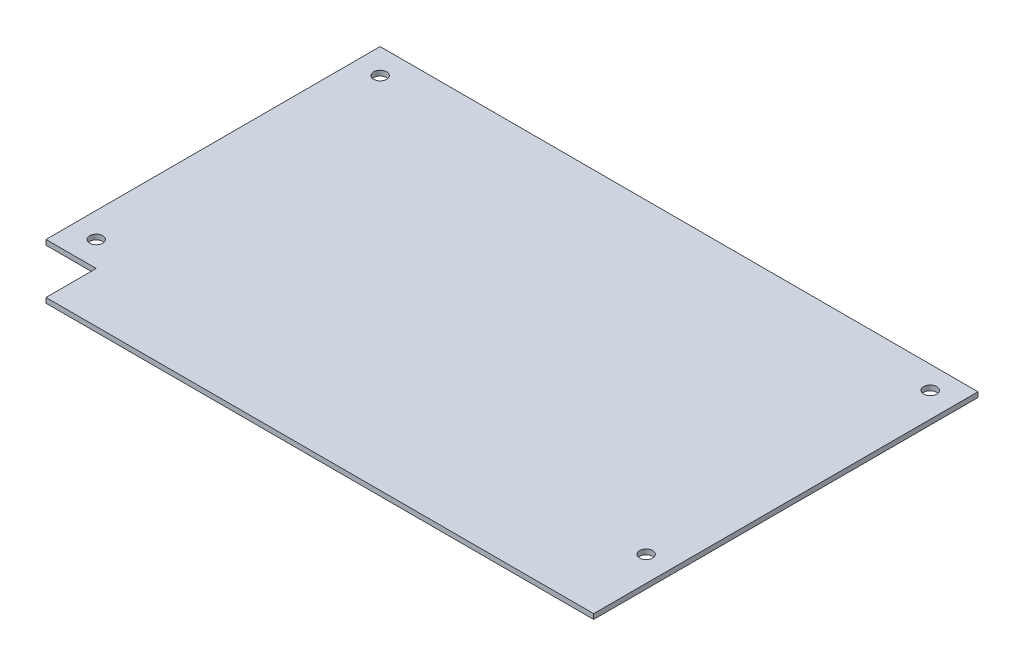
from build123d import *

# Parameters (mm, degrees)
P_IDAT_VYSUNUT_M1_DEPTH  = 2
SKICA2_R                 = 2.6
ODEBRAT_VYSUNUT_M1_DEPTH = 2
SKICA3_R                 = 2.6
ODEBRAT_VYSUNUT_M2_DEPTH = 2


with BuildPart() as part:
    # Skica1 → Přidat vysunutím1 (new body)
    with BuildSketch(Plane(origin=(0, 0, 0), x_dir=(1, 0, 0), z_dir=(0, 1, 0))):
        Polygon((119, -76.5), (-99, -76.5), (-99, -56.5), (-119, -56.5), (-119, 76.5), (119, 76.5), align=None)
    extrude(amount=P_IDAT_VYSUNUT_M1_DEPTH)

    # Skica2 → Odebrat vysunutím1 (cut)
    with BuildSketch(Plane.XZ):
        with Locations(Location((109, 45.604467717, 0), (0, 0, 270))):
            Circle(SKICA2_R)
        with Locations(Location((109, -67.457548012, 0), (0, 0, 270))):
            Circle(SKICA2_R)
    extrude(amount=-ODEBRAT_VYSUNUT_M1_DEPTH, mode=Mode.SUBTRACT)

    # Skica3 → Odebrat vysunutím2 (cut)
    with BuildSketch(Plane(origin=(0, 2, 0), x_dir=(1, 0, 0), z_dir=(0, 1, 0))):
        with Locations(Location((-109, 66.5, 0), (0, 0, 270))):
            Circle(SKICA3_R)
        with Locations(Location((-109, -46.5, 0), (0, 0, 270))):
            Circle(SKICA3_R)
    extrude(amount=-ODEBRAT_VYSUNUT_M2_DEPTH, mode=Mode.SUBTRACT)


solid = part.part
